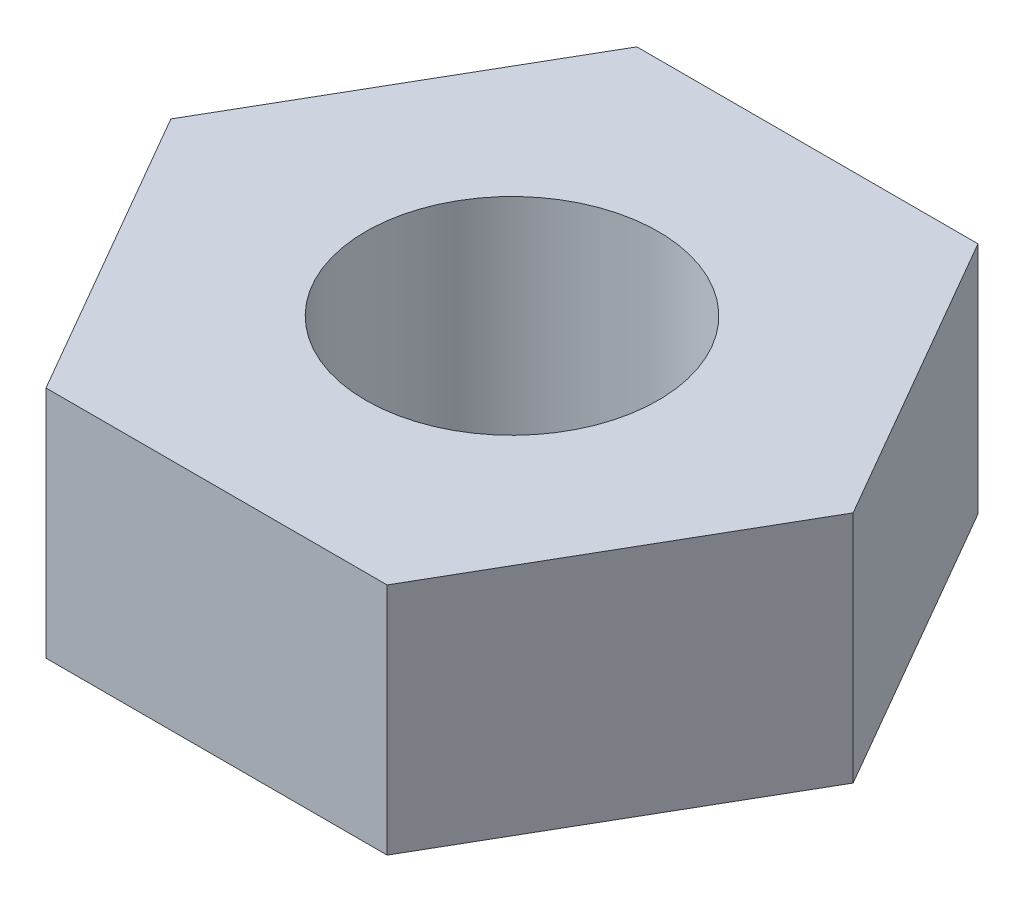
from build123d import *

# Parameters (mm, degrees)
SKETCH1_R           = 1.25
BOSS_EXTRUDE1_DEPTH = 2


with BuildPart() as part:
    # Sketch1 → Boss-Extrude1 (new body)
    with BuildSketch(Plane(origin=(0, 0, 0), x_dir=(1, 0, 0), z_dir=(0, 1, 0))):
        Polygon((2.915618859, 0), (1.45780943, 2.525), (-1.45780943, 2.525), (-2.915618859, 0), (-1.45780943, -2.525), (1.45780943, -2.525), align=None)
        with Locations(Location((0, 0, 0), (0, 0, 270))):
            Circle(SKETCH1_R, mode=Mode.SUBTRACT)
    extrude(amount=BOSS_EXTRUDE1_DEPTH)


solid = part.part
